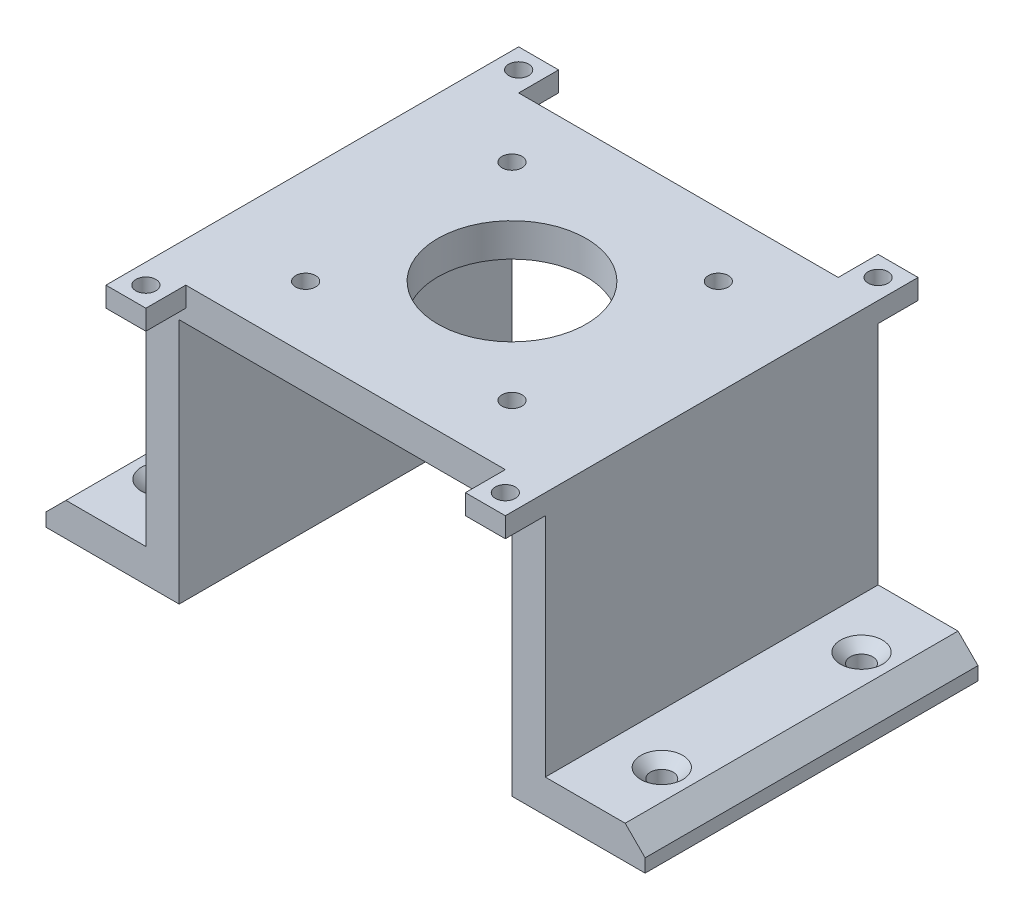
from build123d import *

# Parameters (mm, degrees)
BOSS_EXTRUDE1_DEPTH                             = 50
CSK_FOR_M3_FLAT_HEAD_MACHINE_SCREW1_D           = 3.4
CSK_FOR_M3_FLAT_HEAD_MACHINE_SCREW1_CSINK_D     = 6.3
CSK_FOR_M3_FLAT_HEAD_MACHINE_SCREW1_CSINK_ANGLE = 90
SKETCH8_R                                       = 11.15
CUT_EXTRUDE1_DEPTH                              = 41
F_3_0_3_DIAMETER_HOLE1_D                        = 3
CHAMFER1_SIZE                                   = 3
SKETCH14_W                                      = 6
SKETCH14_H                                      = 6
BOSS_EXTRUDE2_DEPTH                             = 3
F_3_0_3_DIAMETER_HOLE2_D                        = 3


with BuildPart() as part:
    # Sketch2 → Boss-Extrude1 (new body)
    with BuildSketch(Plane.XY):
        Polygon((0, 0), (0, 37), (-50, 37), (-50, 0), (-70, 0), (-70, 5), (-55, 5), (-55, 42), (-50, 42), (5, 42), (5, 5), (20, 5), (20, 0), align=None)
    extrude(amount=BOSS_EXTRUDE1_DEPTH)

    # CSK for M3 Flat Head Machine Screw1 (through all)
    with Locations(Plane(origin=(0, 5, 0), x_dir=(1, 0, 0), z_dir=(0, 1, 0))):
        with Locations((-62.5, -10), (-62.5, -40), (12.5, -40), (12.5, -10)):
            CounterSinkHole(CSK_FOR_M3_FLAT_HEAD_MACHINE_SCREW1_D / 2, CSK_FOR_M3_FLAT_HEAD_MACHINE_SCREW1_CSINK_D / 2, counter_sink_angle=CSK_FOR_M3_FLAT_HEAD_MACHINE_SCREW1_CSINK_ANGLE)

    # Sketch8 → Cut-Extrude1 (cut)
    with BuildSketch(Plane(origin=(0, 42, 0), x_dir=(1, 0, 0), z_dir=(0, 1, 0))):
        with Locations(Location((-25, -25, 0), (0, 0, 180))):
            Circle(SKETCH8_R)
    extrude(amount=-CUT_EXTRUDE1_DEPTH, mode=Mode.SUBTRACT)

    # Ø3.0 (3) Diameter Hole1 (through all)
    with Locations(Plane(origin=(0, 42, 0), x_dir=(1, 0, 0), z_dir=(0, 1, 0))):
        with Locations((-40.5, -40.5), (-40.5, -9.5), (-9.5, -9.5), (-9.5, -40.5)):
            Hole(F_3_0_3_DIAMETER_HOLE1_D / 2)

    # Chamfer1
    chamfer1_edges = [part.edges().sort_by_distance(p)[0] for p in [
        (-70, 5, 25),
        (20, 5, 25),
    ]]
    chamfer(chamfer1_edges, length=CHAMFER1_SIZE)

    # Sketch14 → Boss-Extrude2 (add)
    with BuildSketch(Plane(origin=(0, 42, 0), x_dir=(1, 0, 0), z_dir=(0, 1, 0))):
        with Locations((-52, 3)):
            Rectangle(SKETCH14_W, SKETCH14_H)
        with Locations((-52, -53)):
            Rectangle(SKETCH14_W, SKETCH14_H)
        with Locations((2, 3)):
            Rectangle(SKETCH14_W, SKETCH14_H)
        with Locations((2, -53)):
            Rectangle(SKETCH14_W, SKETCH14_H)
    extrude(amount=-BOSS_EXTRUDE2_DEPTH)

    # Ø3.0 (3) Diameter Hole2 (through all)
    with Locations(Plane(origin=(0, 42, 0), x_dir=(1, 0, 0), z_dir=(0, 1, 0))):
        with Locations((-52, 3), (2, 3), (2, -53), (-52, -53)):
            Hole(F_3_0_3_DIAMETER_HOLE2_D / 2)


solid = part.part
